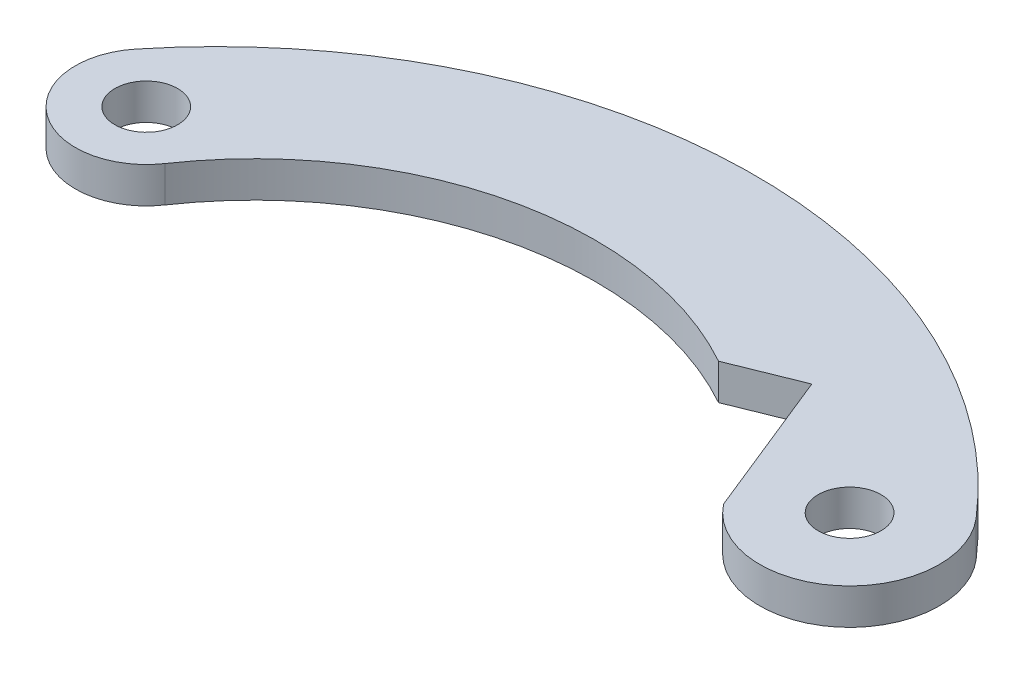
from build123d import *

# Parameters (mm, degrees)
SKETCH1_R               = 1.75
BOSS_EXTRUDE1_DEPTH     = 1
CUT_EXTRUDE1_DEPTH      = 47.247436748
CUT_EXTRUDE1_DEPTH_BACK = 47.247436748


with BuildPart() as part:
    # Sketch1 → Boss-Extrude1 (new, symmetric)
    with BuildSketch(Plane(origin=(0, 0, 0), x_dir=(1, 0, 0), z_dir=(0, 1, 0))):
        with BuildLine():
            ThreePointArc((-3.074068123, 2.480444551), (-2.35494781, -3.171233327), (3.263278519, -2.225648963))
            ThreePointArc((3.263278519, -2.225648963), (19.240732221, 6.066624624), (34.966250056, -2.694021293))
            ThreePointArc((34.966250056, -2.694021293), (42.169032262, -4.007012426), (42.959429057, 3.271674965))
            ThreePointArc((42.959429057, 3.271674965), (19.757716522, 13.637194671), (-3.074068123, 2.480444551))
        make_face()
        with Locations(Location((0, 0, 0), (0, 0, 270))):
            Circle(SKETCH1_R, mode=Mode.SUBTRACT)
        with Locations(Location((39.178405, 0, 0), (0, 0, 270))):
            Circle(SKETCH1_R, mode=Mode.SUBTRACT)
    extrude(amount=BOSS_EXTRUDE1_DEPTH, both=True)

    # Sketch2 → Cut-Extrude1 (cut, two sides: drawn at the far end of the back side and taken through both)
    with BuildSketch(Plane(origin=(0, 0, 0), x_dir=(1, 0, 0), z_dir=(0, 1, 0)).offset(-CUT_EXTRUDE1_DEPTH_BACK)):
        Polygon((36.17646787, -5.383387255), (31.918373047, 5.155767261), (14.230811062, -1.990471652), (18.488905885, -12.529626168), align=None)
    extrude(amount=CUT_EXTRUDE1_DEPTH + CUT_EXTRUDE1_DEPTH_BACK, mode=Mode.SUBTRACT)


solid = part.part
